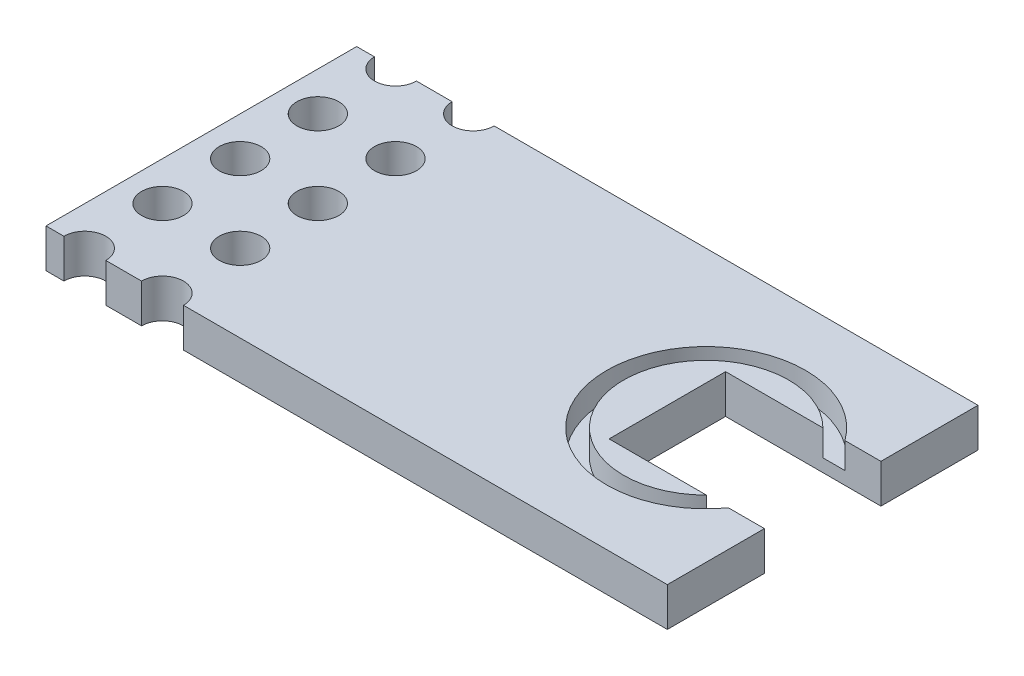
from build123d import *

# Parameters (mm, degrees)
SKETCH1_W           = 152.4
SKETCH1_H           = 88.9
SKETCH1_R           = 3.429
BOSS_EXTRUDE1_DEPTH = 6.35
CUT_EXTRUDE3_START  = 6.35
SKETCH2_R           = 16.25
SKETCH2_R_2         = 13.5
CUT_EXTRUDE3_DEPTH  = 4.25
SKETCH3_W           = 76.2
SKETCH3_H           = 19.05
CUT_EXTRUDE4_DEPTH  = 89.44526556
SKETCH4_OUTSIDE_W   = 189.71
SKETCH4_OUTSIDE_H   = 126.21
SKETCH4_OUTSIDE_W_2 = 101.6
SKETCH4_OUTSIDE_H_2 = 50.8
CUT_EXTRUDE6_DEPTH  = 89.44526556


with BuildPart() as part:
    # Sketch1 → Boss-Extrude1 (new body)
    with BuildSketch(Plane(origin=(0, 0, 0), x_dir=(1, 0, 0), z_dir=(0, 1, 0))):
        Rectangle(SKETCH1_W, SKETCH1_H)
        with Locations(Location((-69.85, 38.1, 0), (0, 0, 270))):
            Circle(SKETCH1_R, mode=Mode.SUBTRACT)
        with Locations(Location((-57.15, 38.1, 0), (0, 0, 270))):
            Circle(SKETCH1_R, mode=Mode.SUBTRACT)
        with Locations(Location((-57.15, 25.4, 0), (0, 0, 270))):
            Circle(SKETCH1_R, mode=Mode.SUBTRACT)
        with Locations(Location((-57.15, 12.7, 0), (0, 0, 270))):
            Circle(SKETCH1_R, mode=Mode.SUBTRACT)
        with Locations(Location((-57.15, 0, 0), (0, 0, 270))):
            Circle(SKETCH1_R, mode=Mode.SUBTRACT)
        with Locations(Location((-57.15, -12.7, 0), (0, 0, 270))):
            Circle(SKETCH1_R, mode=Mode.SUBTRACT)
        with Locations(Location((-57.15, -25.4, 0), (0, 0, 270))):
            Circle(SKETCH1_R, mode=Mode.SUBTRACT)
        with Locations(Location((-57.15, -38.1, 0), (0, 0, 270))):
            Circle(SKETCH1_R, mode=Mode.SUBTRACT)
        with Locations(Location((-69.85, 25.4, 0), (0, 0, 270))):
            Circle(SKETCH1_R, mode=Mode.SUBTRACT)
        with Locations(Location((-69.85, 12.7, 0), (0, 0, 270))):
            Circle(SKETCH1_R, mode=Mode.SUBTRACT)
        with Locations(Location((-69.85, 0, 0), (0, 0, 270))):
            Circle(SKETCH1_R, mode=Mode.SUBTRACT)
        with Locations(Location((-69.85, -12.7, 0), (0, 0, 270))):
            Circle(SKETCH1_R, mode=Mode.SUBTRACT)
        with Locations(Location((-69.85, -25.4, 0), (0, 0, 270))):
            Circle(SKETCH1_R, mode=Mode.SUBTRACT)
        with Locations(Location((-69.85, -38.1, 0), (0, 0, 270))):
            Circle(SKETCH1_R, mode=Mode.SUBTRACT)
    extrude(amount=BOSS_EXTRUDE1_DEPTH)

    # Sketch2 → Cut-Extrude3 (cut)
    with BuildSketch(Plane(origin=(0, 0, 0), x_dir=(1, 0, 0), z_dir=(0, 1, 0)).offset(CUT_EXTRUDE3_START)):
        with Locations(Location((6.35, 0, 0), (0, 0, 90))):
            Circle(SKETCH2_R)
        with Locations(Location((6.35, 0, 0), (0, 0, 90))):
            Circle(SKETCH2_R_2, mode=Mode.SUBTRACT)
    extrude(amount=-CUT_EXTRUDE3_DEPTH, mode=Mode.SUBTRACT)

    # Sketch3 → Cut-Extrude4 (cut, through all)
    with BuildSketch(Plane(origin=(0, 6.35, 0), x_dir=(1, 0, 0), z_dir=(0, 1, 0))):
        with Locations((38.1, 0)):
            Rectangle(SKETCH3_W, SKETCH3_H)
    extrude(amount=-CUT_EXTRUDE4_DEPTH, mode=Mode.SUBTRACT)

    # Sketch4 outside → Cut-Extrude6 (cut, through all)
    with BuildSketch(Plane(origin=(0, 0, 0), x_dir=(1, 0, 0), z_dir=(0, 1, 0))):
        Rectangle(SKETCH4_OUTSIDE_W, SKETCH4_OUTSIDE_H)
        with Locations((-25.4, 0)):
            Rectangle(SKETCH4_OUTSIDE_W_2, SKETCH4_OUTSIDE_H_2, mode=Mode.SUBTRACT)
    extrude(amount=CUT_EXTRUDE6_DEPTH, mode=Mode.SUBTRACT)


solid = part.part
